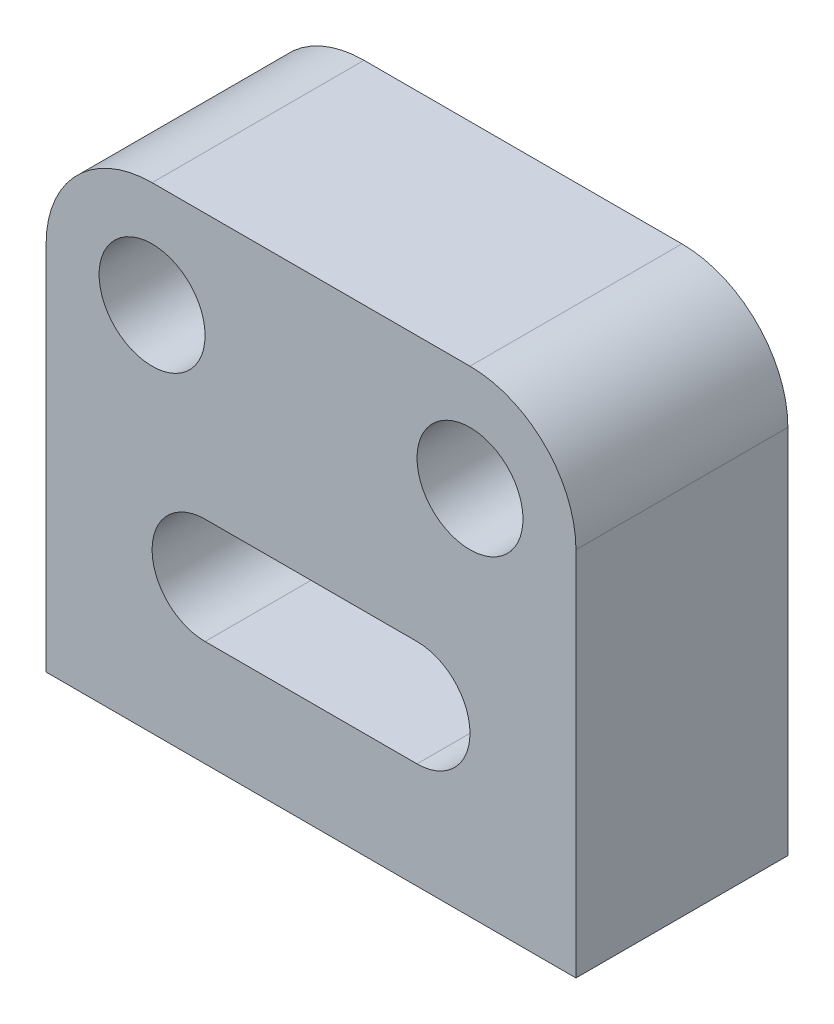
from build123d import *

# Parameters (mm, degrees)
SKETCH1_R           = 10
BOSS_EXTRUDE1_DEPTH = 40


with BuildPart() as part:
    # Sketch1 → Boss-Extrude1 (new body)
    with BuildSketch(Plane.XY):
        with BuildLine():
            Line((50, 0), (-50, 0))
            Line((-50, 0), (-50, 70))
            ThreePointArc((-50, 70), (-44.142135624, 84.142135624), (-30, 90))
            Line((-30, 90), (30, 90))
            ThreePointArc((30, 90), (44.142135624, 84.142135624), (50, 70))
            Line((50, 70), (50, 0))
        make_face()
        with Locations((-30, 70)):
            Circle(SKETCH1_R, mode=Mode.SUBTRACT)
        with Locations(Location((30, 70, 0), (0, 0, 180))):
            Circle(SKETCH1_R, mode=Mode.SUBTRACT)
        with BuildLine():
            Line((-20, 40), (20, 40))
            ThreePointArc((20, 40), (30, 30), (20, 20))
            Line((20, 20), (-20, 20))
            ThreePointArc((-20, 20), (-30, 30), (-20, 40))
        make_face(mode=Mode.SUBTRACT)
    extrude(amount=BOSS_EXTRUDE1_DEPTH)


solid = part.part
